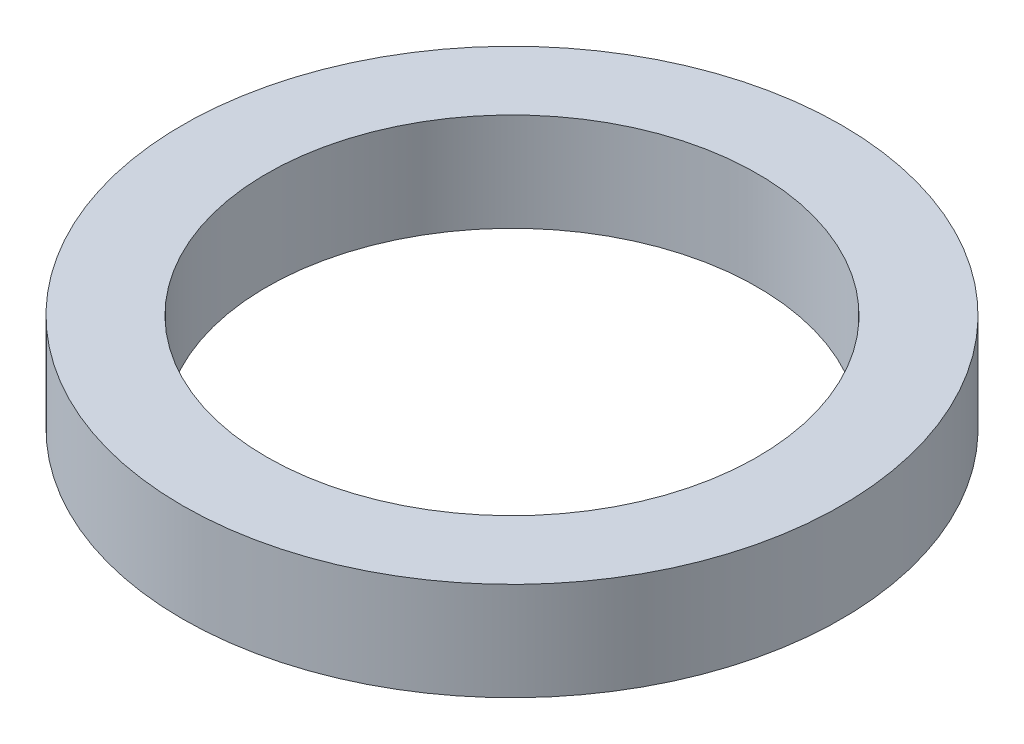
from build123d import *

# Parameters (mm, degrees)
SKETCH1_R           = 23.5
SKETCH1_R_2         = 17.5
BOSS_EXTRUDE1_DEPTH = 3.5


with BuildPart() as part:
    # Sketch1 → Boss-Extrude1 (new, symmetric)
    with BuildSketch(Plane(origin=(0, 0, 0), x_dir=(1, 0, 0), z_dir=(0, 1, 0))):
        with Locations(Location((0, 0, 0), (0, 0, 270))):
            Circle(SKETCH1_R)
        with Locations(Location((0, 0, 0), (0, 0, 270))):
            Circle(SKETCH1_R_2, mode=Mode.SUBTRACT)
    extrude(amount=BOSS_EXTRUDE1_DEPTH, both=True)


solid = part.part
